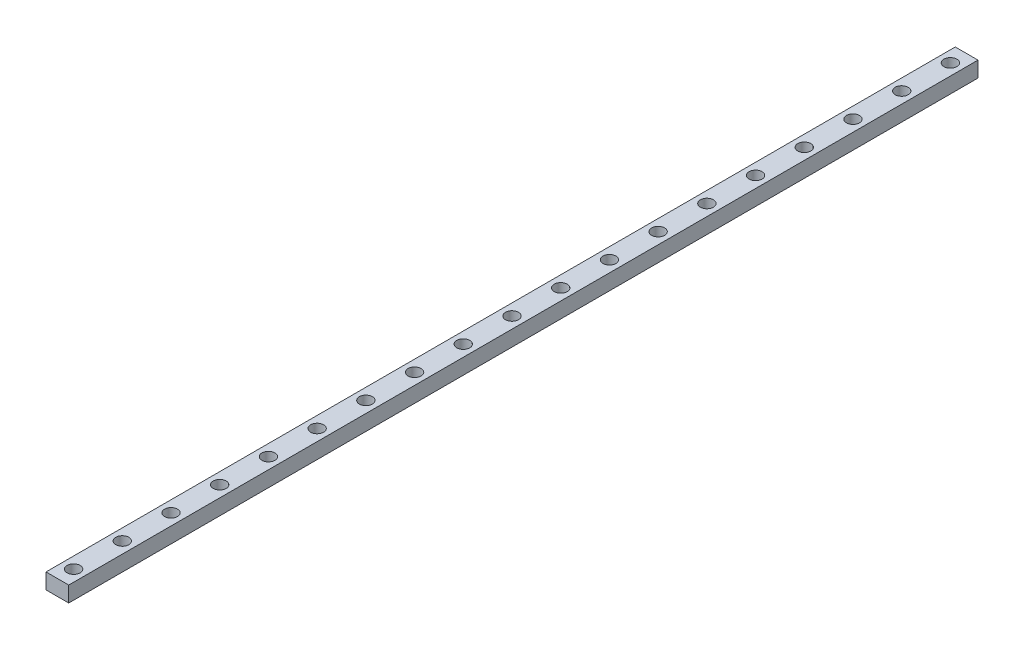
from build123d import *

# Parameters (mm, degrees)
SKETCH_1_W             = 7
SKETCH_1_H             = 4.8
EXTRUDE_1_DEPTH        = 280
SKETCH_2_R             = 2
CUT_EXTRUDE_1_DEPTH    = 3
SKETCH_3_R             = 1
CUT_EXTRUDE_2_DEPTH    = 3
PATTERN_LINEAR_1_COUNT = 19
PATTERN_LINEAR_1_PITCH = 15
PATTERN_LINEAR_2_COUNT = 19
PATTERN_LINEAR_2_PITCH = 15


with BuildPart() as part:
    # 草图1 → 凸台-拉伸1 (new body)
    with BuildSketch(Plane.XY):
        Rectangle(SKETCH_1_W, SKETCH_1_H)
    extrude(amount=EXTRUDE_1_DEPTH)

    # 草图2 → 切除-拉伸1 (cut)
    with BuildSketch(Plane(origin=(0, 2.4, 0), x_dir=(1, 0, 0), z_dir=(0, 1, 0))):
        with Locations(Location((0, -5, 0), (0, 0, 270))):
            Circle(SKETCH_2_R)
    cut_extrude_1 = extrude(amount=-CUT_EXTRUDE_1_DEPTH, mode=Mode.SUBTRACT)

    # 草图3 → 切除-拉伸2 (cut)
    with BuildSketch(Plane(origin=(0, -0.6, 0), x_dir=(1, 0, 0), z_dir=(0, 1, 0))):
        with Locations(Location((0, -5, 0), (0, 0, 270))):
            Circle(SKETCH_3_R)
    cut_extrude_2 = extrude(amount=-CUT_EXTRUDE_2_DEPTH, mode=Mode.SUBTRACT)

    # 阵列(线性)1: 切除-拉伸2 ×19
    with Locations(*[(0, 0, i * PATTERN_LINEAR_1_PITCH) for i in range(1, PATTERN_LINEAR_1_COUNT)]):
        add(cut_extrude_2, mode=Mode.SUBTRACT)

    # 阵列(线性)2: 切除-拉伸1 ×19
    with Locations(*[(0, 0, i * PATTERN_LINEAR_2_PITCH) for i in range(1, PATTERN_LINEAR_2_COUNT)]):
        add(cut_extrude_1, mode=Mode.SUBTRACT)


solid = part.part
